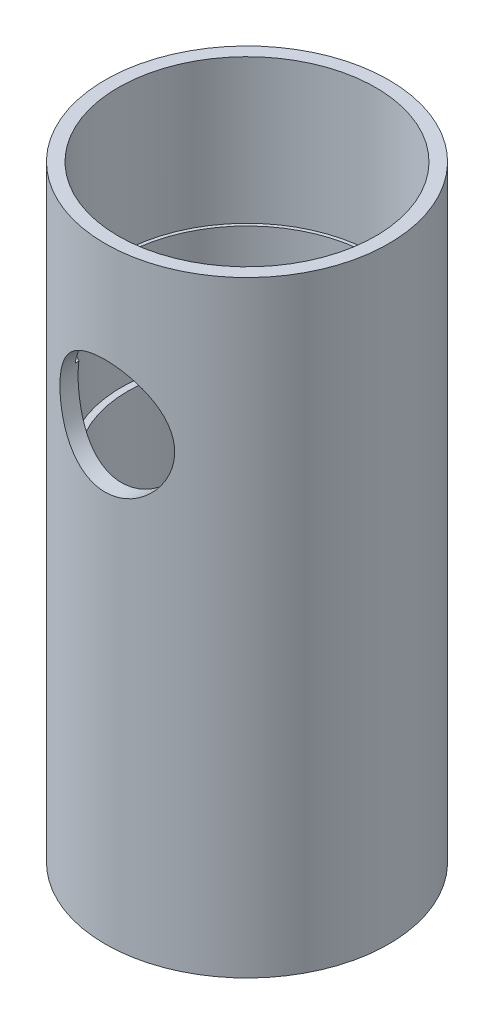
from build123d import *

# Parameters (mm, degrees)
SKETCH1_R           = 43.25
SKETCH1_R_2         = 38.25
BOSS_EXTRUDE1_DEPTH = 92.5
BOSS_EXTRUDE2_START = -6.35
SKETCH2_R           = 38.25
SKETCH2_R_2         = 36.25
BOSS_EXTRUDE2_DEPTH = 100
SKETCH5_R           = 17.5
CUT_EXTRUDE2_DEPTH  = 111.893530019
CUT_EXTRUDE3_START  = -44
SKETCH6_R           = 39.25
SKETCH6_R_2         = 38.25
CUT_EXTRUDE3_DEPTH  = 44


with BuildPart() as part:
    # Sketch1 → Boss-Extrude1 (new, symmetric)
    with BuildSketch(Plane(origin=(0, 0, 0), x_dir=(1, 0, 0), z_dir=(0, 1, 0))):
        with Locations(Location((0, 0, 0), (0, 0, 270))):
            Circle(SKETCH1_R)
        with Locations(Location((0, 0, 0), (0, 0, 270))):
            Circle(SKETCH1_R_2, mode=Mode.SUBTRACT)
    extrude(amount=BOSS_EXTRUDE1_DEPTH, both=True)

    # Sketch2 → Boss-Extrude2 (add)
    with BuildSketch(Plane.XZ.offset(92.5).offset(BOSS_EXTRUDE2_START)):
        with Locations(Location((0, 0, 0), (0, 0, 270))):
            Circle(SKETCH2_R)
        with Locations(Location((0, 0, 0), (0, 0, 270))):
            Circle(SKETCH2_R_2, mode=Mode.SUBTRACT)
    extrude(amount=-BOSS_EXTRUDE2_DEPTH)

    # Sketch5 → Cut-Extrude2 (cut, through all)
    with BuildSketch(Plane.XY):
        with Locations(Location((0, 44.35, 0), (0, 0, 180))):
            Circle(SKETCH5_R)
    extrude(amount=CUT_EXTRUDE2_DEPTH, mode=Mode.SUBTRACT)

    # Sketch6 → Cut-Extrude3 (cut)
    with BuildSketch(Plane(origin=(0, 92.5, 0), x_dir=(1, 0, 0), z_dir=(0, 1, 0)).offset(CUT_EXTRUDE3_START)):
        with Locations(Location((0, 0, 0), (0, 0, 270))):
            Circle(SKETCH6_R)
        with Locations(Location((0, 0, 0), (0, 0, 90))):
            Circle(SKETCH6_R_2, mode=Mode.SUBTRACT)
    extrude(amount=CUT_EXTRUDE3_DEPTH, mode=Mode.SUBTRACT)


solid = part.part
